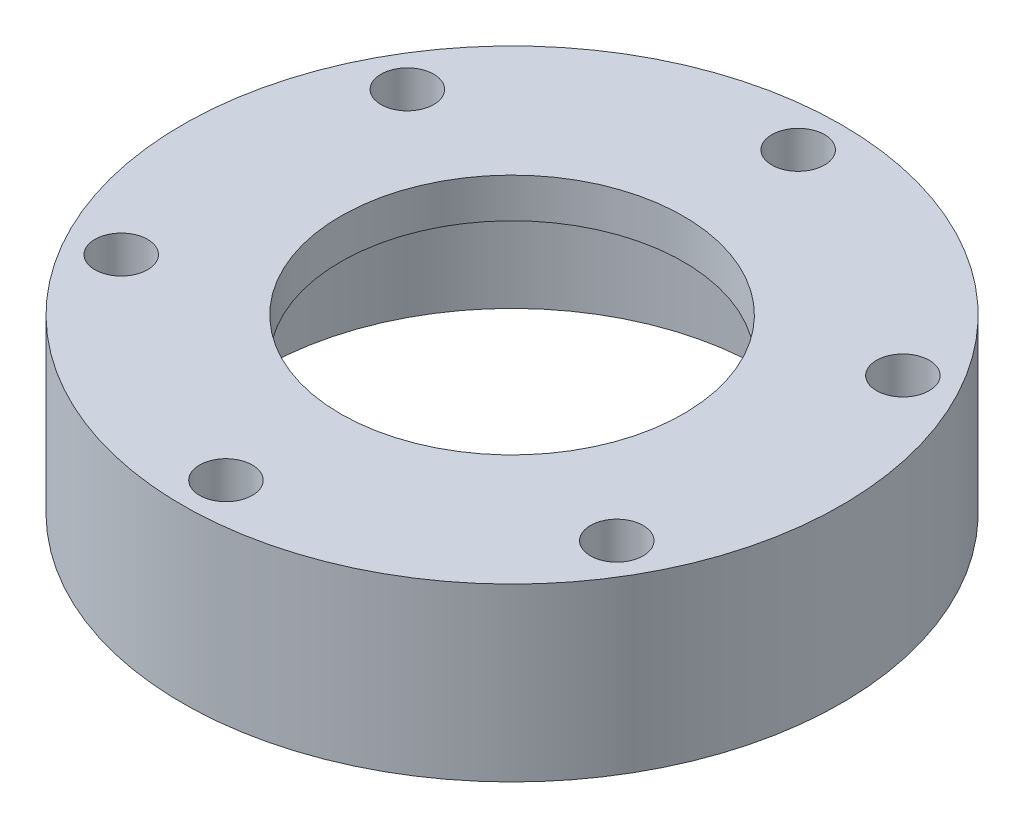
from build123d import *

# Parameters (mm, degrees)
SKETCH_1_R          = 25
EXTRUDE_1_DEPTH     = 13
SKETCH_3_R          = 2
CUT_EXTRUDE_3_DEPTH = 38.669616404
SKETCH_4_R          = 19
CUT_EXTRUDE_1_DEPTH = 10
SKETCH_5_R          = 13
CUT_EXTRUDE_2_DEPTH = 38.669616404


with BuildPart() as part:
    # Эскиз1 → Вытянуть1 (new body)
    with BuildSketch(Plane(origin=(0, 0, 0), x_dir=(1, 0, 0), z_dir=(0, 1, 0))):
        with Locations(Location((0, 0, 0), (0, 0, 90))):
            Circle(SKETCH_1_R)
    extrude(amount=EXTRUDE_1_DEPTH)

    # Эскиз3 → Вытянуть3 (cut, through all)
    with BuildSketch(Plane(origin=(0, 0, 0), x_dir=(1, 0, 0), z_dir=(0, 1, 0))):
        with Locations(Location((0, 21.703286444, 0), (0, 0, 90))):
            Circle(SKETCH_3_R)
        with Locations(Location((18.795597406, 10.851643222, 0), (0, 0, 90))):
            Circle(SKETCH_3_R)
        with Locations(Location((18.795597406, -10.851643222, 0), (0, 0, 90))):
            Circle(SKETCH_3_R)
        with Locations(Location((0, -21.703286444, 0), (0, 0, 90))):
            Circle(SKETCH_3_R)
        with Locations(Location((-18.795597406, -10.851643222, 0), (0, 0, 90))):
            Circle(SKETCH_3_R)
        with Locations(Location((-18.795597406, 10.851643222, 0), (0, 0, 90))):
            Circle(SKETCH_3_R)
    extrude(amount=CUT_EXTRUDE_3_DEPTH, mode=Mode.SUBTRACT)

    # Эскиз4 → Вырез-Вытянуть1 (cut)
    with BuildSketch(Plane.XZ):
        with Locations(Location((0, 0, 0), (0, 0, 270))):
            Circle(SKETCH_4_R)
    extrude(amount=-CUT_EXTRUDE_1_DEPTH, mode=Mode.SUBTRACT)

    # Эскиз5 → Вырез-Вытянуть2 (cut, through all)
    with BuildSketch(Plane(origin=(0, 13, 0), x_dir=(1, 0, 0), z_dir=(0, 1, 0))):
        with Locations(Location((0, 0, 0), (0, 0, 270))):
            Circle(SKETCH_5_R)
    extrude(amount=-CUT_EXTRUDE_2_DEPTH, mode=Mode.SUBTRACT)


solid = part.part
